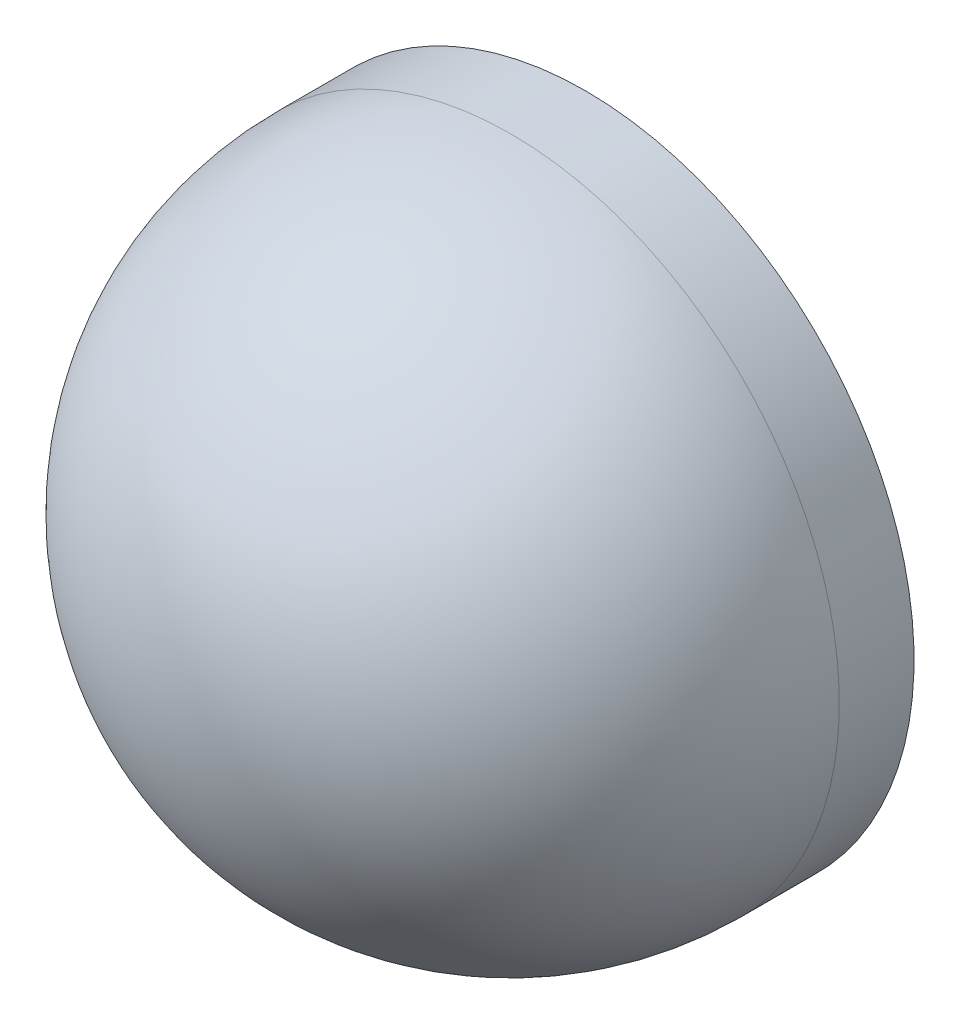
from build123d import *

# Parameters (mm, degrees)
REVOLVE_1_ANGLE = 180
SKETCH_2_R      = 13.2
SKETCH_2_R_2    = 11.7
EXTRUDE_1_DEPTH = 3


with BuildPart() as part:
    # 草图1 → 旋转1 (revolve)
    with BuildSketch(Plane.XY):
        with BuildLine():
            ThreePointArc((-13.2, 0), (0, 13.2), (13.2, 0))
            Line((13.2, 0), (11.7, 0))
            ThreePointArc((11.7, 0), (0, 11.7), (-11.7, 0))
            Line((-11.7, 0), (-13.2, 0))
        make_face()
    revolve(axis=Axis((11.7, 0, 0), (1, 0, 0)), revolution_arc=REVOLVE_1_ANGLE)

    # 草图2 → 凸台-拉伸1 (add)
    with BuildSketch(Plane(origin=(0, 0, 0), x_dir=(-1, 0, 0), z_dir=(0, 0, -1))):
        with Locations(Location((0, 0, 0), (0, 0, 90))):
            Circle(SKETCH_2_R)
        with Locations(Location((0, 0, 0), (0, 0, 180))):
            Circle(SKETCH_2_R_2, mode=Mode.SUBTRACT)
    extrude(amount=EXTRUDE_1_DEPTH)


solid = part.part
